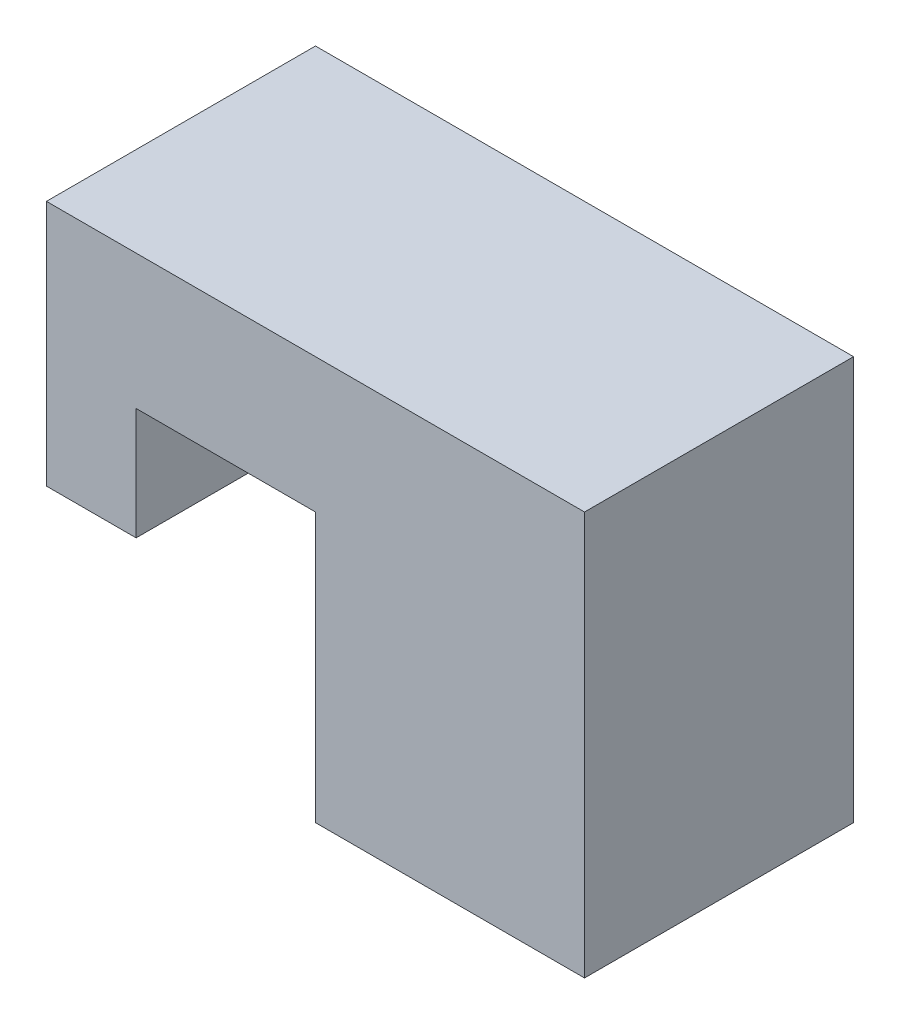
from build123d import *

# Parameters (mm, degrees)
SKETCH1_W           = 6
SKETCH1_H           = 6
BOSS_EXTRUDE1_DEPTH = 6
SKETCH2_W           = 12
SKETCH2_H           = 6
BOSS_EXTRUDE2_DEPTH = 3
SKETCH3_W           = 2
SKETCH3_H           = 6
BOSS_EXTRUDE3_DEPTH = 2.5


with BuildPart() as part:
    # Sketch1 → Boss-Extrude1 (new body)
    with BuildSketch(Plane(origin=(0, 0, 0), x_dir=(1, 0, 0), z_dir=(0, 1, 0))):
        Rectangle(SKETCH1_W, SKETCH1_H)
    extrude(amount=BOSS_EXTRUDE1_DEPTH)

    # Sketch2 → Boss-Extrude2 (add)
    with BuildSketch(Plane(origin=(0, 6, 0), x_dir=(1, 0, 0), z_dir=(0, 1, 0))):
        with Locations((-3, 0)):
            Rectangle(SKETCH2_W, SKETCH2_H)
    extrude(amount=BOSS_EXTRUDE2_DEPTH)

    # Sketch3 → Boss-Extrude3 (add)
    with BuildSketch(Plane.XZ.offset(-6)):
        with Locations((-8, 0)):
            Rectangle(SKETCH3_W, SKETCH3_H)
    extrude(amount=BOSS_EXTRUDE3_DEPTH)


solid = part.part
